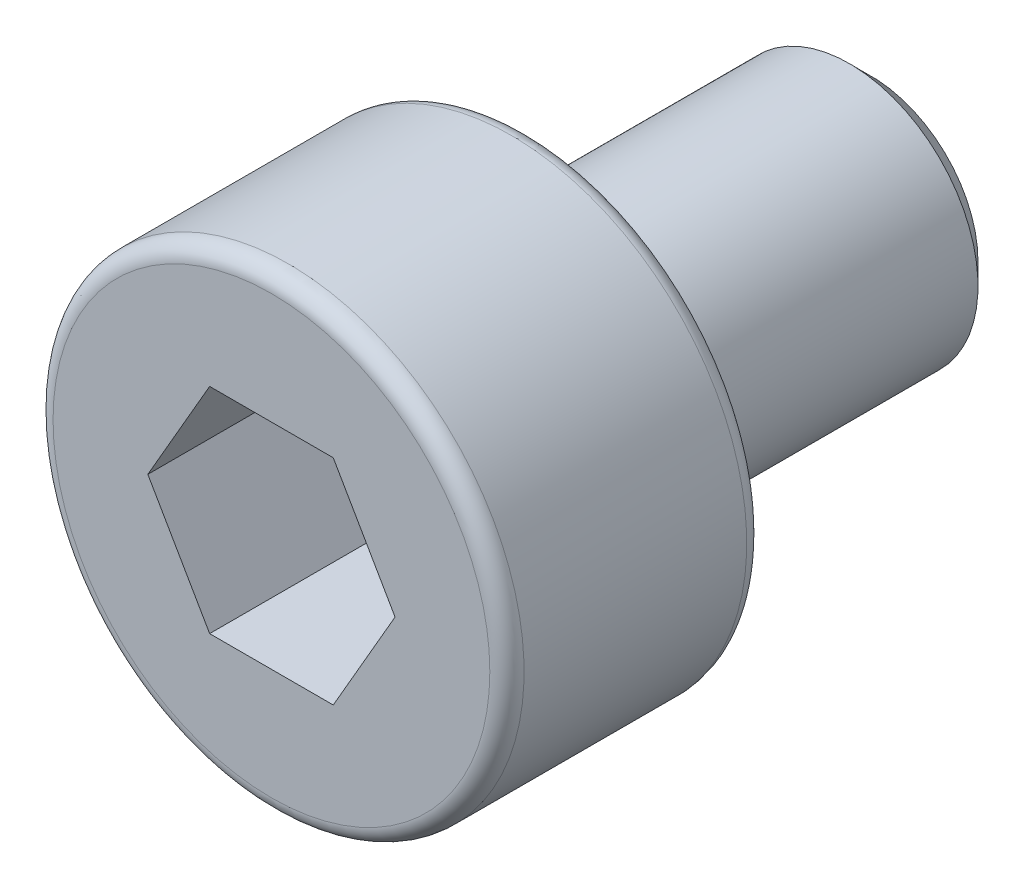
from build123d import *

# Parameters (mm, degrees)
SKETCH1_R           = 2.75
BOSS_EXTRUDE1_DEPTH = 3
SKETCH2_R           = 1.5
BOSS_EXTRUDE2_DEPTH = 4
CUT_EXTRUDE1_DEPTH  = 2
CHAMFER1_SIZE       = 0.25
FILLET1_R           = 0.2


with BuildPart() as part:
    # Sketch1 → Boss-Extrude1 (new body)
    with BuildSketch(Plane.XY.offset(7)):
        Circle(SKETCH1_R)
    extrude(amount=-BOSS_EXTRUDE1_DEPTH)

    # Sketch2 → Boss-Extrude2 (add)
    with BuildSketch(Plane(origin=(0, 0, 4), x_dir=(-1, 0, 0), z_dir=(0, 0, -1))):
        Circle(SKETCH2_R)
    extrude(amount=BOSS_EXTRUDE2_DEPTH)

    # Sketch3 → Cut-Extrude1 (cut)
    with BuildSketch(Plane.XY.offset(7)):
        Polygon((-1.443375673, 0), (-0.721687836, -1.25), (0.721687836, -1.25), (1.443375673, 0), (0.721687836, 1.25), (-0.721687836, 1.25), align=None)
    extrude(amount=-CUT_EXTRUDE1_DEPTH, mode=Mode.SUBTRACT)

    # Chamfer1
    chamfer1_edges = [part.edges().sort_by_distance(p)[0] for p in [
        (1.5, 0, 0),
    ]]
    chamfer(chamfer1_edges, length=CHAMFER1_SIZE)

    # Fillet1
    fillet1_edges = [part.edges().sort_by_distance(p)[0] for p in [
        (-2.75, 0, 4),
        (-2.75, 0, 7),
    ]]
    fillet(fillet1_edges, radius=FILLET1_R)


solid = part.part
